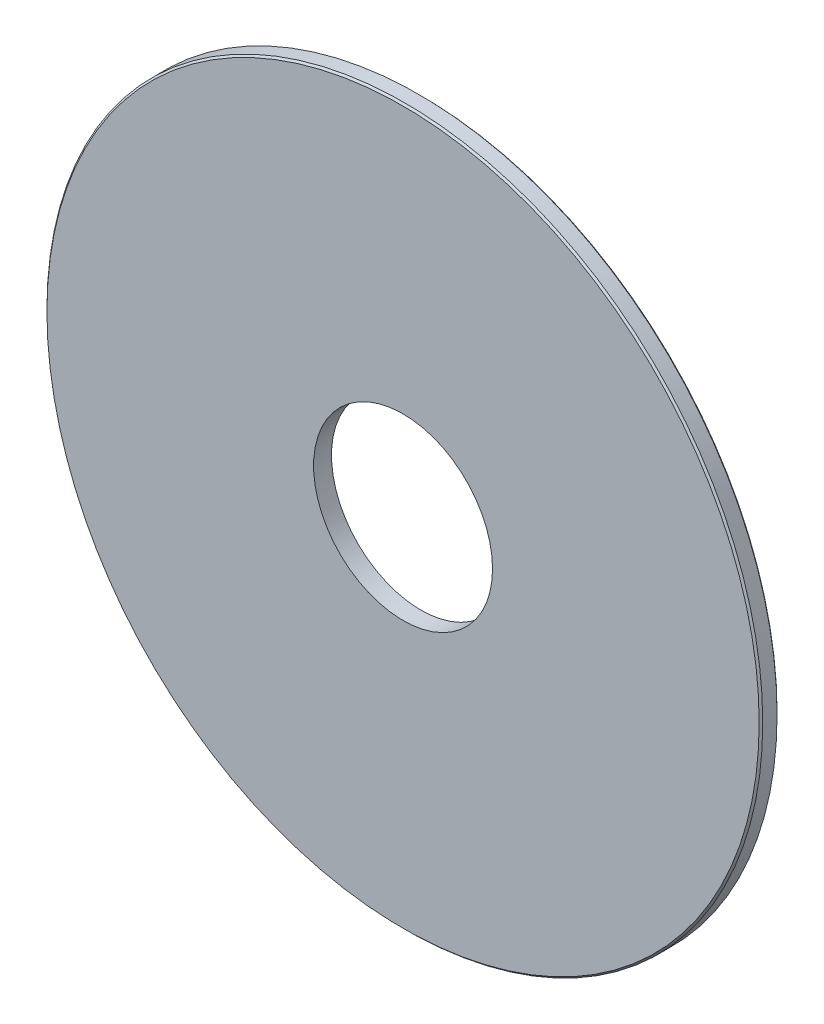
from build123d import *

# Parameters (mm, degrees)
SKETCH1_R           = 40
SKETCH1_R_2         = 10
BOSS_EXTRUDE1_DEPTH = 2
CHAMFER1_SIZE       = 0.2


with BuildPart() as part:
    # Sketch1 → Boss-Extrude1 (new body)
    with BuildSketch(Plane.XY):
        Circle(SKETCH1_R)
        Circle(SKETCH1_R_2, mode=Mode.SUBTRACT)
    extrude(amount=BOSS_EXTRUDE1_DEPTH)

    # Chamfer1
    chamfer1_edges = [part.edges().sort_by_distance(p)[0] for p in [
        (-40, 0, 0),
        (-40, 0, 2),
    ]]
    chamfer(chamfer1_edges, length=CHAMFER1_SIZE)


solid = part.part
